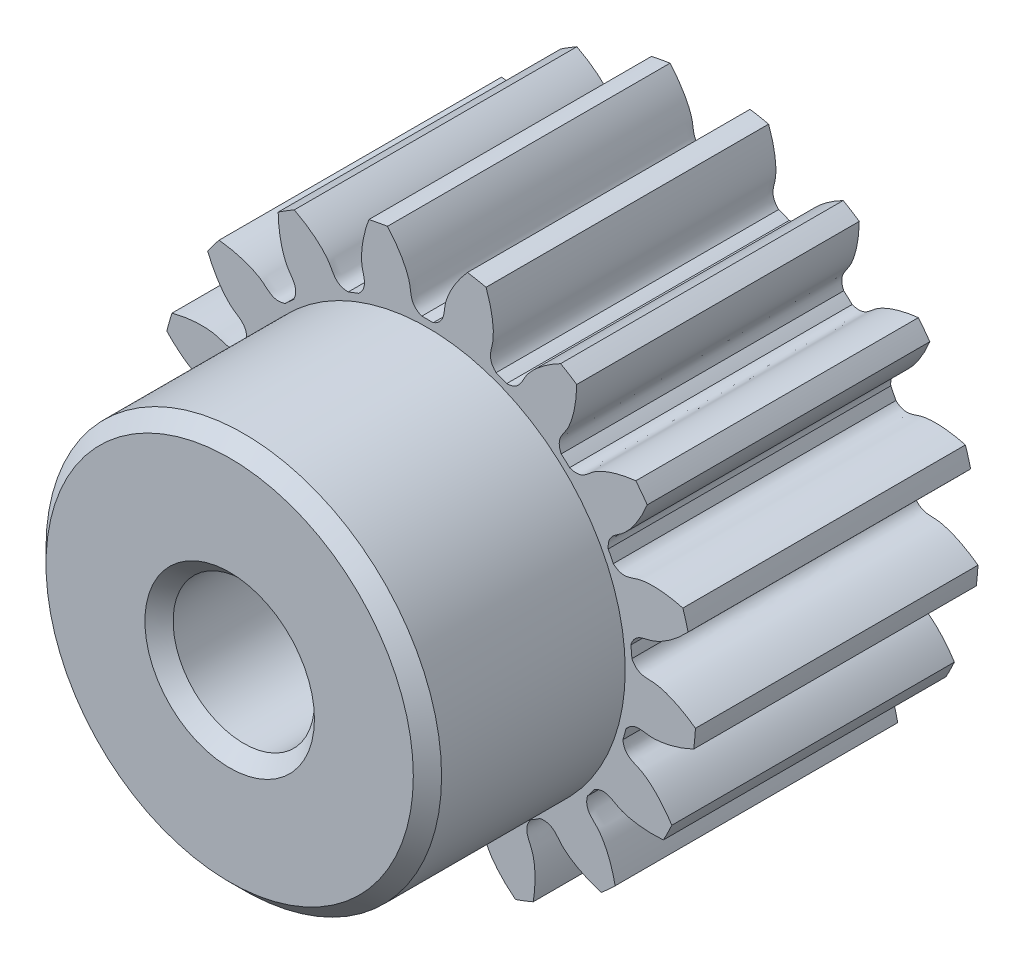
from build123d import *

# Parameters (mm, degrees)
SKETCH_1_R               = 19
EXTRUDE_1_DEPTH          = 20
CUT_EXTRUDE_1_DEPTH      = 34.496268449
PATTERN_CIRCULAR_1_COUNT = 17
SKETCH_4_R               = 14
EXTRUDE_2_DEPTH          = 14
SKETCH_5_R               = 5
CUT_EXTRUDE_2_DEPTH      = 44.322352223
CHAMFER_1_SIZE           = 1


with BuildPart() as part:
    # 草图1 → 凸台-拉伸1 (new body)
    with BuildSketch(Plane.XY):
        Circle(SKETCH_1_R)
    extrude(amount=EXTRUDE_1_DEPTH)

    # 草图2 → 切除-拉伸1 (cut, through all)
    with BuildSketch(Plane.XY):
        with BuildLine():
            ThreePointArc((0.403387494, 14.494387829), (0, 14.5), (-0.403387494, 14.494387829))
            add(Edge.make_bspline(
                [(-0.403387494, 14.494387829), (-1.255759481, 14.849644042), (-1.132390756, 15.509626813), (-1.276611209, 16.129648275), (-1.289951469, 16.18230119), (-1.306037005, 16.240838627), (-1.32510118, 16.305170665), (-1.347383555, 16.375198727), (-1.373118159, 16.450817515), (-1.40253689, 16.531914502), (-1.435868224, 16.618370188), (-1.473337358, 16.710058129), (-1.515165928, 16.80684504), (-1.561571855, 16.908590882), (-1.612769151, 17.015148962), (-1.66896775, 17.12636603), (-1.730373323, 17.242082389), (-1.797187111, 17.362132), (-1.869605751, 17.4863426), (-1.947821109, 17.61453582), (-2.032020115, 17.746527309), (-2.1223846, 17.882126855), (-2.219091138, 18.021138524), (-2.32231089, 18.163360791), (-2.432209452, 18.308586678), (-2.548946705, 18.456603899), (-2.67267667, 18.607195006), (-2.803547366, 18.760137539), (-2.941700674, 18.915204179), (-3.087272199, 19.072162909), (-3.24039114, 19.23077717), (-3.401180166, 19.390806026), (-3.569755292, 19.552004336), (-3.746225758, 19.71412292), (-3.930693918, 19.876908731), (-4.123255131, 20.040105038), (-4.323997649, 20.203451599), (-4.533002522, 20.366684847), (-4.750343497, 20.529538073), (-4.976086928, 20.691741613), (-5.210291694, 20.853023038), (-5.453009069, 21.013107349), (-5.79164327, 21.226861067), (-6.053153804, 21.381051942), (-6.231291666, 21.481438237)],
                knots=[0, 0, 0, 0, 0.193882922, 0.199023975, 0.204850501, 0.211362501, 0.218559975, 0.226442923, 0.235011345, 0.24426524, 0.254204608, 0.264829451, 0.276139767, 0.288135557, 0.300816821, 0.314183558, 0.328235769, 0.342973453, 0.358396612, 0.374505244, 0.39129935, 0.408778929, 0.426943982, 0.445794509, 0.46533051, 0.485551984, 0.506458932, 0.528051354, 0.550329249, 0.573292619, 0.596941461, 0.621275778, 0.646295568, 0.672000832, 0.69839157, 0.725467781, 0.753229466, 0.781676625, 0.810809257, 0.840627364, 0.871130943, 0.902319997, 0.934194524, 1, 1, 1, 1], degree=3))
            ThreePointArc((-6.231291666, 21.481438237), (0, 22.366966369), (6.231291666, 21.481438237))
            add(Edge.make_bspline(
                [(0.403387494, 14.494387829), (1.255759481, 14.849644042), (1.132390756, 15.509626813), (1.276611209, 16.129648275), (1.289951469, 16.18230119), (1.306037005, 16.240838627), (1.32510118, 16.305170665), (1.347383555, 16.375198727), (1.373118159, 16.450817515), (1.40253689, 16.531914502), (1.435868224, 16.618370188), (1.473337358, 16.710058129), (1.515165928, 16.80684504), (1.561571855, 16.908590882), (1.612769151, 17.015148962), (1.66896775, 17.12636603), (1.730373323, 17.242082389), (1.797187111, 17.362132), (1.869605751, 17.4863426), (1.947821109, 17.61453582), (2.032020115, 17.746527309), (2.1223846, 17.882126855), (2.219091138, 18.021138524), (2.32231089, 18.163360791), (2.432209452, 18.308586678), (2.548946705, 18.456603899), (2.67267667, 18.607195006), (2.803547366, 18.760137539), (2.941700674, 18.915204179), (3.087272199, 19.072162909), (3.24039114, 19.23077717), (3.401180166, 19.390806026), (3.569755292, 19.552004336), (3.746225758, 19.71412292), (3.930693918, 19.876908731), (4.123255131, 20.040105038), (4.323997649, 20.203451599), (4.533002522, 20.366684847), (4.750343497, 20.529538073), (4.976086928, 20.691741613), (5.210291694, 20.853023038), (5.453009069, 21.013107349), (5.79164327, 21.226861067), (6.053153804, 21.381051942), (6.231291666, 21.481438237)],
                knots=[0, 0, 0, 0, 0.193882922, 0.199023975, 0.204850501, 0.211362501, 0.218559975, 0.226442923, 0.235011345, 0.24426524, 0.254204608, 0.264829451, 0.276139767, 0.288135557, 0.300816821, 0.314183558, 0.328235769, 0.342973453, 0.358396612, 0.374505244, 0.39129935, 0.408778929, 0.426943982, 0.445794509, 0.46533051, 0.485551984, 0.506458932, 0.528051354, 0.550329249, 0.573292619, 0.596941461, 0.621275778, 0.646295568, 0.672000832, 0.69839157, 0.725467781, 0.753229466, 0.781676625, 0.810809257, 0.840627364, 0.871130943, 0.902319997, 0.934194524, 1, 1, 1, 1], degree=3))
        make_face()
    cut_extrude_1 = extrude(amount=CUT_EXTRUDE_1_DEPTH, mode=Mode.SUBTRACT)

    # 阵列(圆周)1: 切除-拉伸1 ×17 about axis
    pattern_circular_1_axis = Axis((0, 0, 20), (0, 0, -1))
    for i in range(1, PATTERN_CIRCULAR_1_COUNT):
        add(cut_extrude_1.rotate(pattern_circular_1_axis, i * 360 / PATTERN_CIRCULAR_1_COUNT), mode=Mode.SUBTRACT)

    # 草图4 → 凸台-拉伸2 (add)
    with BuildSketch(Plane.XY.offset(20)):
        Circle(SKETCH_4_R)
    extrude(amount=EXTRUDE_2_DEPTH)

    # 草图5 → 切除-拉伸2 (cut, through all)
    with BuildSketch(Plane.XY.offset(34)):
        Circle(SKETCH_5_R)
    extrude(amount=-CUT_EXTRUDE_2_DEPTH, mode=Mode.SUBTRACT)

    # 倒角1
    chamfer_1_edges = [part.edges().sort_by_distance(p)[0] for p in [
        (-5, 0, 0),
        (-5, 0, 34),
        (-14, 0, 34),
    ]]
    chamfer(chamfer_1_edges, length=CHAMFER_1_SIZE)


solid = part.part
